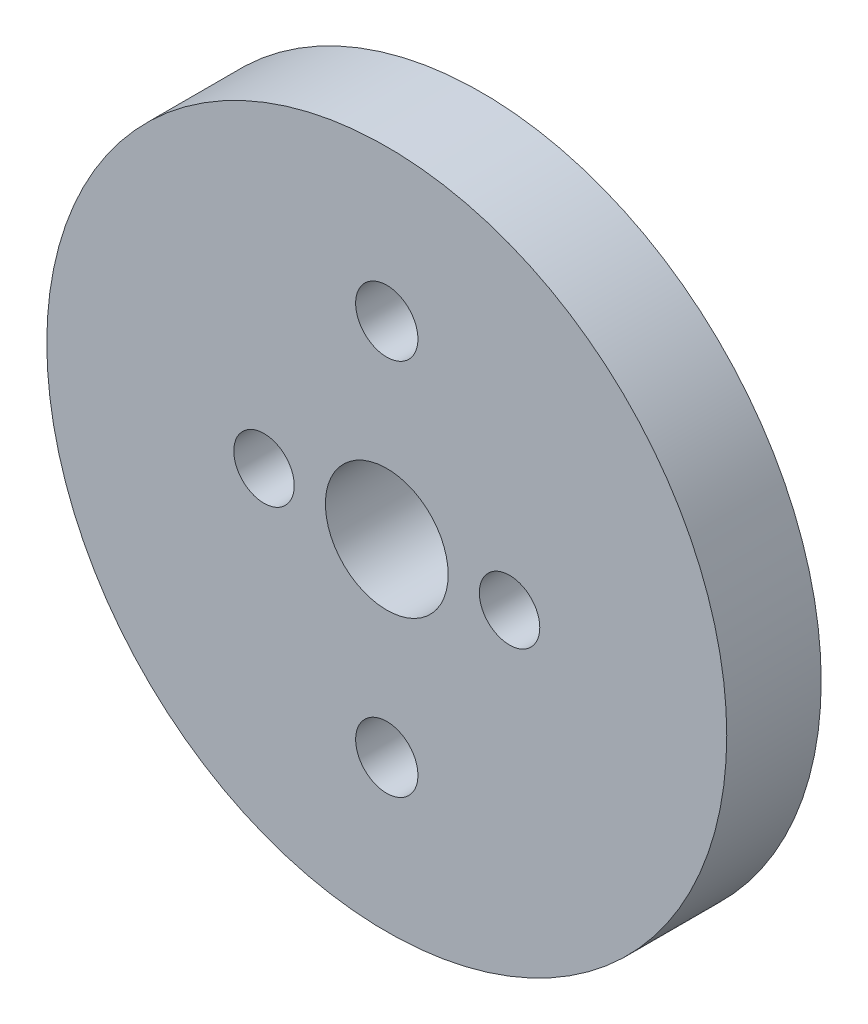
from build123d import *

# Parameters (mm, degrees)
SKETCH_1_R          = 18
SKETCH_1_R_2        = 3.25
SKETCH_1_R_3        = 1.6
EXTRUDE_1_DEPTH     = 5
SKETCH_2_R          = 1.65
CUT_EXTRUDE_1_DEPTH = 26.942243542


with BuildPart() as part:
    # ｽｹｯﾁ1 → ﾎﾞｽ - 押し出し1 (new body)
    with BuildSketch(Plane.XY):
        Circle(SKETCH_1_R)
        Circle(SKETCH_1_R_2, mode=Mode.SUBTRACT)
        with Locations((6.5, 0)):
            Circle(SKETCH_1_R_3, mode=Mode.SUBTRACT)
        with Locations(Location((-6.5, 0, 0), (0, 0, 180))):
            Circle(SKETCH_1_R_3, mode=Mode.SUBTRACT)
    extrude(amount=EXTRUDE_1_DEPTH)

    # ｽｹｯﾁ2 → ｶｯﾄ - 押し出し1 (cut, through all)
    with BuildSketch(Plane.XY.offset(5)):
        with Locations((0, 10)):
            Circle(SKETCH_2_R)
        with Locations(Location((0, -10, 0), (0, 0, 180))):
            Circle(SKETCH_2_R)
    extrude(amount=-CUT_EXTRUDE_1_DEPTH, mode=Mode.SUBTRACT)


solid = part.part
